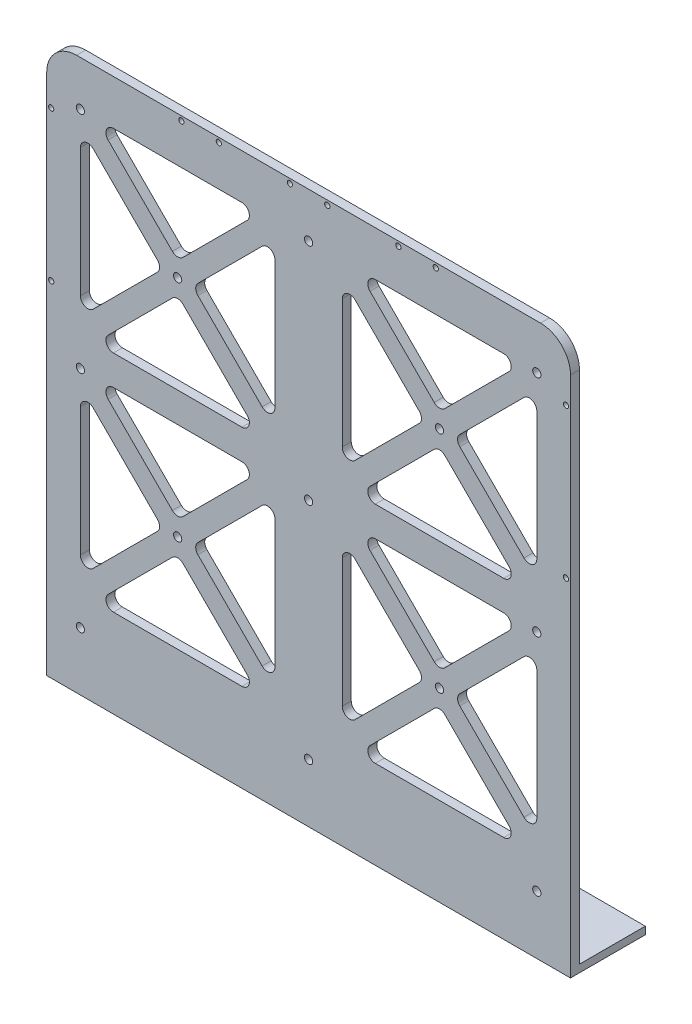
from build123d import *

# Parameters (mm, degrees)
SKETCH_1_W          = 350
SKETCH_1_H          = 50
SKETCH_1_R          = 2.75
EXTRUDE_1_DEPTH     = 5
SKETCH_2_W          = 350
SKETCH_2_H          = 6
EXTRUDE_2_DEPTH     = 364
SKETCH_3_R          = 2.75
CUT_EXTRUDE_1_DEPTH = 500
SKETCH_4_R          = 1.75
CUT_EXTRUDE_2_DEPTH = 10
FILLET_1_R          = 20
SKETCH_5_R          = 1.75
CUT_EXTRUDE_3_DEPTH = 10


with BuildPart() as part:
    # 草图1 → 凸台-拉伸1 (new body)
    with BuildSketch(Plane(origin=(0, 0, 0), x_dir=(1, 0, 0), z_dir=(0, 1, 0))):
        with Locations((0, 25)):
            Rectangle(SKETCH_1_W, SKETCH_1_H)
        with Locations(Location((130, 25, 0), (0, 0, 270))):
            Circle(SKETCH_1_R, mode=Mode.SUBTRACT)
        with Locations(Location((50, 25, 0), (0, 0, 270))):
            Circle(SKETCH_1_R, mode=Mode.SUBTRACT)
        with Locations(Location((-130, 25, 0), (0, 0, 90))):
            Circle(SKETCH_1_R, mode=Mode.SUBTRACT)
        with Locations(Location((-50, 25, 0), (0, 0, 90))):
            Circle(SKETCH_1_R, mode=Mode.SUBTRACT)
    extrude(amount=EXTRUDE_1_DEPTH)

    # 草图2 → 凸台-拉伸2 (add)
    with BuildSketch(Plane(origin=(0, 5, 0), x_dir=(1, 0, 0), z_dir=(0, 1, 0))):
        with Locations((0, 3)):
            Rectangle(SKETCH_2_W, SKETCH_2_H)
    extrude(amount=EXTRUDE_2_DEPTH)

    # 草图3 → 切除-拉伸1 (cut)
    with BuildSketch(Plane(origin=(0, 0, -6), x_dir=(-1, 0, 0), z_dir=(0, 0, -1))):
        with Locations((87.5, 274)):
            Circle(SKETCH_3_R)
        with Locations((87.5, 124)):
            Circle(SKETCH_3_R)
        with Locations((-87.5, 124)):
            Circle(SKETCH_3_R)
        with Locations((-87.5, 274)):
            Circle(SKETCH_3_R)
        with Locations((152.5, 339)):
            Circle(SKETCH_3_R)
        with Locations((152.5, 189)):
            Circle(SKETCH_3_R)
        with Locations((152.5, 39)):
            Circle(SKETCH_3_R)
        with Locations((-152.5, 39)):
            Circle(SKETCH_3_R)
        with Locations((-152.5, 189)):
            Circle(SKETCH_3_R)
        with Locations((-152.5, 339)):
            Circle(SKETCH_3_R)
        with Locations((0, 339)):
            Circle(SKETCH_3_R)
        with Locations((0, 189)):
            Circle(SKETCH_3_R)
        with Locations((0, 39)):
            Circle(SKETCH_3_R)
        with BuildLine():
            Line((83.964466094, 137.535533906), (41.035533906, 180.464466094))
            ThreePointArc((41.035533906, 180.464466094), (39.951670149, 185.913417162), (44.571067812, 189))
            Line((44.571067812, 189), (130.428932188, 189))
            ThreePointArc((130.428932188, 189), (135.048329851, 185.913417162), (133.964466094, 180.464466094))
            Line((133.964466094, 180.464466094), (91.035533906, 137.535533906))
            ThreePointArc((91.035533906, 137.535533906), (87.5, 136.071067812), (83.964466094, 137.535533906))
        make_face()
        with BuildLine():
            Line((44.571067812, 339), (130.428932188, 339))
            ThreePointArc((130.428932188, 339), (135.048329851, 335.913417162), (133.964466094, 330.464466094))
            Line((133.964466094, 330.464466094), (91.035533906, 287.535533906))
            ThreePointArc((91.035533906, 287.535533906), (87.5, 286.071067812), (83.964466094, 287.535533906))
            Line((83.964466094, 287.535533906), (41.035533906, 330.464466094))
            ThreePointArc((41.035533906, 330.464466094), (39.951670149, 335.913417162), (44.571067812, 339))
        make_face()
        with BuildLine():
            Line((73.964466094, 120.464466094), (31.035533906, 77.535533906))
            ThreePointArc((31.035533906, 77.535533906), (25.586582838, 76.451670149), (22.5, 81.071067812))
            Line((22.5, 81.071067812), (22.5, 166.928932188))
            ThreePointArc((22.5, 166.928932188), (25.586582838, 171.548329851), (31.035533906, 170.464466094))
            Line((31.035533906, 170.464466094), (73.964466094, 127.535533906))
            ThreePointArc((73.964466094, 127.535533906), (75.428932188, 124), (73.964466094, 120.464466094))
        make_face()
        with BuildLine():
            Line((101.035533906, 277.535533906), (143.964466094, 320.464466094))
            ThreePointArc((143.964466094, 320.464466094), (149.413417162, 321.548329851), (152.5, 316.928932188))
            Line((152.5, 316.928932188), (152.5, 231.071067812))
            ThreePointArc((152.5, 231.071067812), (149.413417162, 226.451670149), (143.964466094, 227.535533906))
            Line((143.964466094, 227.535533906), (101.035533906, 270.464466094))
            ThreePointArc((101.035533906, 270.464466094), (99.571067812, 274), (101.035533906, 277.535533906))
        make_face()
        with BuildLine():
            Line((91.035533906, 260.464466094), (133.964466094, 217.535533906))
            ThreePointArc((133.964466094, 217.535533906), (135.048329851, 212.086582838), (130.428932188, 209))
            Line((130.428932188, 209), (44.571067812, 209))
            ThreePointArc((44.571067812, 209), (39.951670149, 212.086582838), (41.035533906, 217.535533906))
            Line((41.035533906, 217.535533906), (83.964466094, 260.464466094))
            ThreePointArc((83.964466094, 260.464466094), (87.5, 261.928932188), (91.035533906, 260.464466094))
        make_face()
        with BuildLine():
            Line((73.964466094, 270.464466094), (31.035533906, 227.535533906))
            ThreePointArc((31.035533906, 227.535533906), (25.586582838, 226.451670149), (22.5, 231.071067812))
            Line((22.5, 231.071067812), (22.5, 316.928932188))
            ThreePointArc((22.5, 316.928932188), (25.586582838, 321.548329851), (31.035533906, 320.464466094))
            Line((31.035533906, 320.464466094), (73.964466094, 277.535533906))
            ThreePointArc((73.964466094, 277.535533906), (75.428932188, 274), (73.964466094, 270.464466094))
        make_face()
        with BuildLine():
            Line((101.035533906, 127.535533906), (143.964466094, 170.464466094))
            ThreePointArc((143.964466094, 170.464466094), (149.413417162, 171.548329851), (152.5, 166.928932188))
            Line((152.5, 166.928932188), (152.5, 81.071067812))
            ThreePointArc((152.5, 81.071067812), (149.413417162, 76.451670149), (143.964466094, 77.535533906))
            Line((143.964466094, 77.535533906), (101.035533906, 120.464466094))
            ThreePointArc((101.035533906, 120.464466094), (99.571067812, 124), (101.035533906, 127.535533906))
        make_face()
        with BuildLine():
            Line((91.035533906, 110.464466094), (133.964466094, 67.535533906))
            ThreePointArc((133.964466094, 67.535533906), (135.048329851, 62.086582838), (130.428932188, 59))
            Line((130.428932188, 59), (44.571067812, 59))
            ThreePointArc((44.571067812, 59), (39.951670149, 62.086582838), (41.035533906, 67.535533906))
            Line((41.035533906, 67.535533906), (83.964466094, 110.464466094))
            ThreePointArc((83.964466094, 110.464466094), (87.5, 111.928932188), (91.035533906, 110.464466094))
        make_face()
        with BuildLine():
            Line((-91.035533906, 137.535533906), (-133.964466094, 180.464466094))
            ThreePointArc((-133.964466094, 180.464466094), (-135.048329851, 185.913417162), (-130.428932188, 189))
            Line((-130.428932188, 189), (-44.571067812, 189))
            ThreePointArc((-44.571067812, 189), (-39.951670149, 185.913417162), (-41.035533906, 180.464466094))
            Line((-41.035533906, 180.464466094), (-83.964466094, 137.535533906))
            ThreePointArc((-83.964466094, 137.535533906), (-87.5, 136.071067812), (-91.035533906, 137.535533906))
        make_face()
        with BuildLine():
            Line((-101.035533906, 120.464466094), (-143.964466094, 77.535533906))
            ThreePointArc((-143.964466094, 77.535533906), (-149.413417162, 76.451670149), (-152.5, 81.071067812))
            Line((-152.5, 81.071067812), (-152.5, 166.928932188))
            ThreePointArc((-152.5, 166.928932188), (-149.413417162, 171.548329851), (-143.964466094, 170.464466094))
            Line((-143.964466094, 170.464466094), (-101.035533906, 127.535533906))
            ThreePointArc((-101.035533906, 127.535533906), (-99.571067812, 124), (-101.035533906, 120.464466094))
        make_face()
        with BuildLine():
            Line((-73.964466094, 127.535533906), (-31.035533906, 170.464466094))
            ThreePointArc((-31.035533906, 170.464466094), (-25.586582838, 171.548329851), (-22.5, 166.928932188))
            Line((-22.5, 166.928932188), (-22.5, 81.071067812))
            ThreePointArc((-22.5, 81.071067812), (-25.586582838, 76.451670149), (-31.035533906, 77.535533906))
            Line((-31.035533906, 77.535533906), (-73.964466094, 120.464466094))
            ThreePointArc((-73.964466094, 120.464466094), (-75.428932188, 124), (-73.964466094, 127.535533906))
        make_face()
        with BuildLine():
            Line((-83.964466094, 110.464466094), (-41.035533906, 67.535533906))
            ThreePointArc((-41.035533906, 67.535533906), (-39.951670149, 62.086582838), (-44.571067812, 59))
            Line((-44.571067812, 59), (-130.428932188, 59))
            ThreePointArc((-130.428932188, 59), (-135.048329851, 62.086582838), (-133.964466094, 67.535533906))
            Line((-133.964466094, 67.535533906), (-91.035533906, 110.464466094))
            ThreePointArc((-91.035533906, 110.464466094), (-87.5, 111.928932188), (-83.964466094, 110.464466094))
        make_face()
        with BuildLine():
            Line((-91.035533906, 287.535533906), (-133.964466094, 330.464466094))
            ThreePointArc((-133.964466094, 330.464466094), (-135.048329851, 335.913417162), (-130.428932188, 339))
            Line((-130.428932188, 339), (-44.571067812, 339))
            ThreePointArc((-44.571067812, 339), (-39.951670149, 335.913417162), (-41.035533906, 330.464466094))
            Line((-41.035533906, 330.464466094), (-83.964466094, 287.535533906))
            ThreePointArc((-83.964466094, 287.535533906), (-87.5, 286.071067812), (-91.035533906, 287.535533906))
        make_face()
        with BuildLine():
            Line((-101.035533906, 270.464466094), (-143.964466094, 227.535533906))
            ThreePointArc((-143.964466094, 227.535533906), (-149.413417162, 226.451670149), (-152.5, 231.071067812))
            Line((-152.5, 231.071067812), (-152.5, 316.928932188))
            ThreePointArc((-152.5, 316.928932188), (-149.413417162, 321.548329851), (-143.964466094, 320.464466094))
            Line((-143.964466094, 320.464466094), (-101.035533906, 277.535533906))
            ThreePointArc((-101.035533906, 277.535533906), (-99.571067812, 274), (-101.035533906, 270.464466094))
        make_face()
        with BuildLine():
            Line((-73.964466094, 277.535533906), (-31.035533906, 320.464466094))
            ThreePointArc((-31.035533906, 320.464466094), (-25.586582838, 321.548329851), (-22.5, 316.928932188))
            Line((-22.5, 316.928932188), (-22.5, 231.071067812))
            ThreePointArc((-22.5, 231.071067812), (-25.586582838, 226.451670149), (-31.035533906, 227.535533906))
            Line((-31.035533906, 227.535533906), (-73.964466094, 270.464466094))
            ThreePointArc((-73.964466094, 270.464466094), (-75.428932188, 274), (-73.964466094, 277.535533906))
        make_face()
        with BuildLine():
            Line((-83.964466094, 260.464466094), (-41.035533906, 217.535533906))
            ThreePointArc((-41.035533906, 217.535533906), (-39.951670149, 212.086582838), (-44.571067812, 209))
            Line((-44.571067812, 209), (-130.428932188, 209))
            ThreePointArc((-130.428932188, 209), (-135.048329851, 212.086582838), (-133.964466094, 217.535533906))
            Line((-133.964466094, 217.535533906), (-91.035533906, 260.464466094))
            ThreePointArc((-91.035533906, 260.464466094), (-87.5, 261.928932188), (-83.964466094, 260.464466094))
        make_face()
    extrude(amount=-CUT_EXTRUDE_1_DEPTH, mode=Mode.SUBTRACT)

    # 草图4 → 切除-拉伸2 (cut)
    with BuildSketch(Plane.XY):
        with Locations((60, 366)):
            Circle(SKETCH_4_R)
        with Locations((85, 366)):
            Circle(SKETCH_4_R)
        with Locations((12.5, 366)):
            Circle(SKETCH_4_R)
        with Locations((-12.5, 366)):
            Circle(SKETCH_4_R)
        with Locations((-85, 366)):
            Circle(SKETCH_4_R)
        with Locations((-60, 366)):
            Circle(SKETCH_4_R)
    extrude(amount=-CUT_EXTRUDE_2_DEPTH, mode=Mode.SUBTRACT)

    # 圆角1
    fillet_1_edges = [part.edges().sort_by_distance(p)[0] for p in [
        (-175, 369, -3),
        (175, 369, -3),
    ]]
    fillet(fillet_1_edges, radius=FILLET_1_R)

    # 草图5 → 切除-拉伸3 (cut)
    with BuildSketch(Plane(origin=(0, 0, -6), x_dir=(-1, 0, 0), z_dir=(0, 0, -1))):
        with Locations((172, 330)):
            Circle(SKETCH_5_R)
        with Locations((172, 230)):
            Circle(SKETCH_5_R)
        with Locations((-172, 230)):
            Circle(SKETCH_5_R)
        with Locations((-172, 330)):
            Circle(SKETCH_5_R)
    extrude(amount=-CUT_EXTRUDE_3_DEPTH, mode=Mode.SUBTRACT)


solid = part.part
